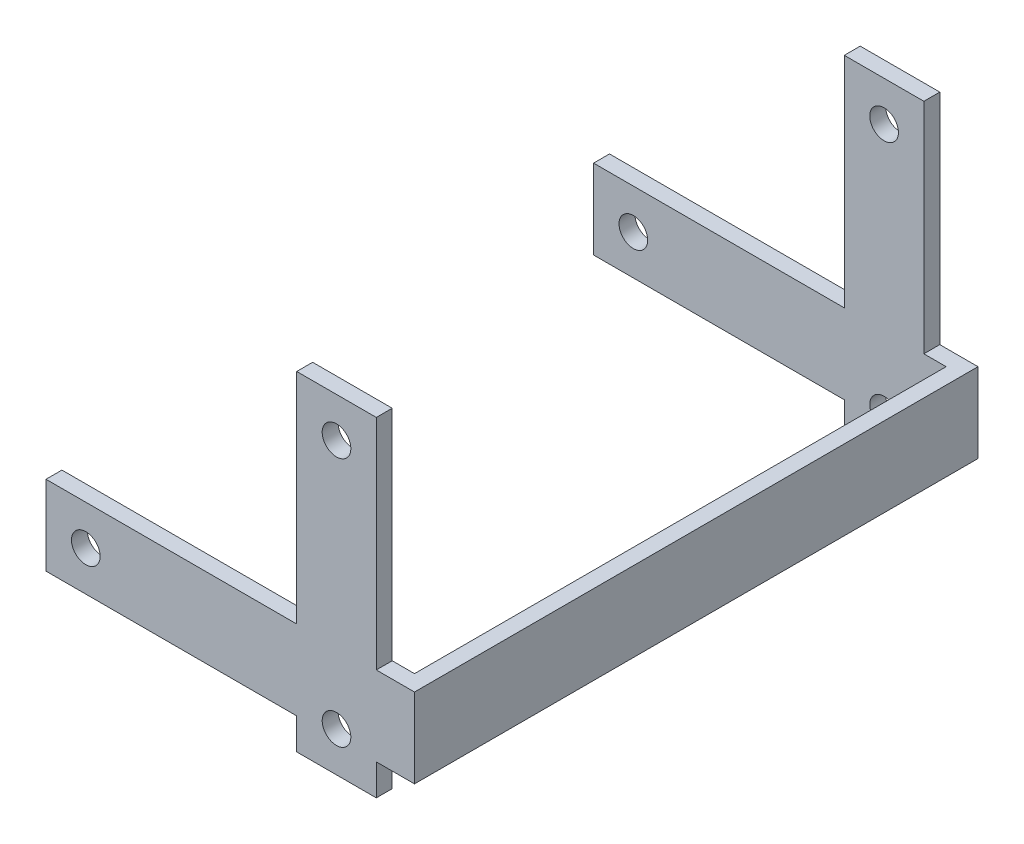
from build123d import *

# Parameters (mm, degrees)
SKETCH1_R           = 4.5
BOSS_EXTRUDE1_DEPTH = 5
SKETCH2_W           = 5
SKETCH2_H           = 25
BOSS_EXTRUDE2_DEPTH = 83.5


with BuildPart() as part:
    # Sketch1 → Boss-Extrude1 (new body)
    with BuildSketch(Plane.XY):
        Polygon((0, 0), (-78.75, 0), (-78.75, -25), (0, -25), (0, -34.8), (25, -34.8), (25, -25), (37, -25), (37, 0), (25, 0), (25, 68.7), (0, 68.7), align=None)
        with Locations((-66.25, -12.5)):
            Circle(SKETCH1_R, mode=Mode.SUBTRACT)
        with Locations((12.5, -22.3)):
            Circle(SKETCH1_R, mode=Mode.SUBTRACT)
        with Locations((12.5, 56.2)):
            Circle(SKETCH1_R, mode=Mode.SUBTRACT)
    extrude(amount=BOSS_EXTRUDE1_DEPTH)

    # Sketch2 → Boss-Extrude2 (add)
    with BuildSketch(Plane(origin=(0, 0, 0), x_dir=(-1, 0, 0), z_dir=(0, 0, -1))):
        with Locations((-34.5, -12.5)):
            Rectangle(SKETCH2_W, SKETCH2_H)
    extrude(amount=BOSS_EXTRUDE2_DEPTH)

    # Mirror5: part across plane


with BuildPart() as part_1:
    add(part.part)
    add(part.part.mirror(Plane(origin=(0, 0, -83.5), x_dir=(1, 0, 0), z_dir=(0, 0, -1))))


solid = part_1.part
